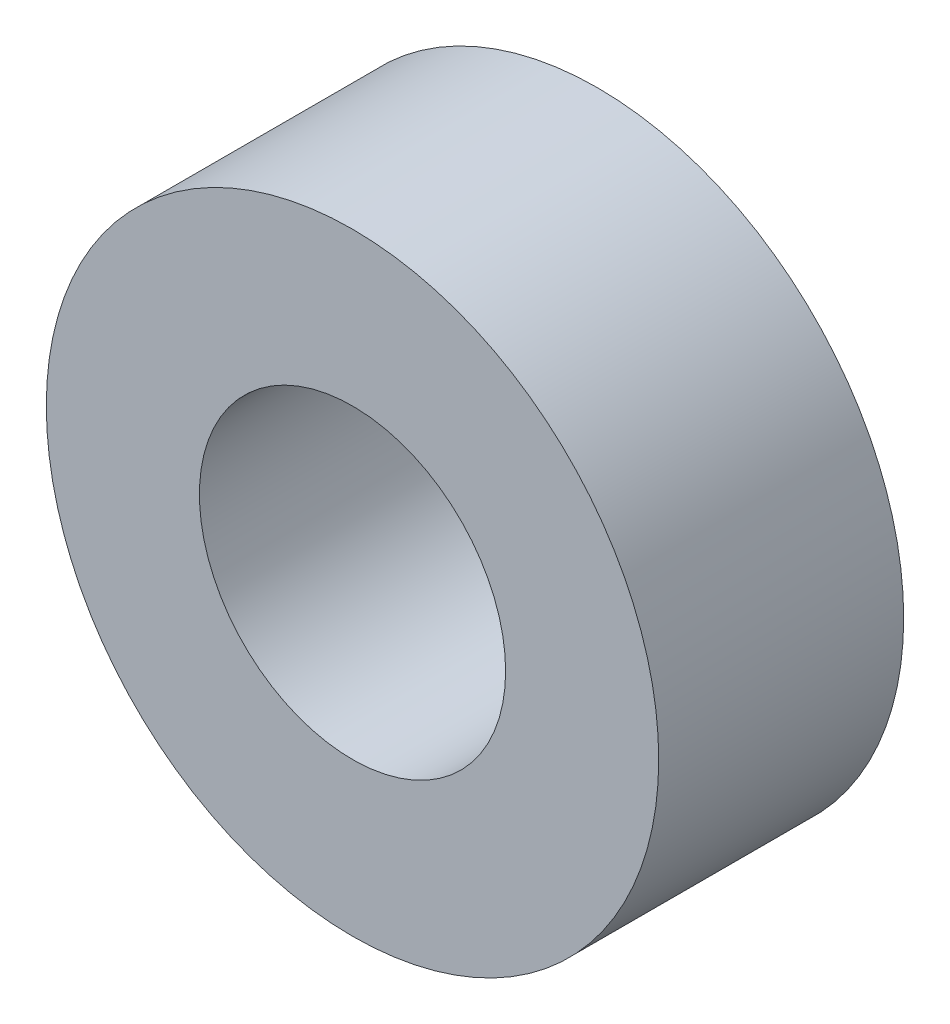
from build123d import *

# Parameters (mm, degrees)
SKETCH_1_R          = 6
EXTRUDE_1_DEPTH     = 1
SKETCH_2_R          = 5
EXTRUDE_2_DEPTH     = 3
SKETCH_3_R          = 2.5
CUT_EXTRUDE_1_DEPTH = 7
CUT_EXTRUDE_START   = -10
SKETCH_4_R          = 6
SKETCH_4_R_2        = 5
CUT_EXTRUDE_2_DEPTH = 10


with BuildPart() as part:
    # 草图1 → 凸台-拉伸1 (new body)
    with BuildSketch(Plane.XY):
        Circle(SKETCH_1_R)
    extrude(amount=EXTRUDE_1_DEPTH)

    # 草图2 → 凸台-拉伸2 (add)
    with BuildSketch(Plane.XY.offset(1)):
        Circle(SKETCH_2_R)
    extrude(amount=EXTRUDE_2_DEPTH)

    # 草图3 → 切除-拉伸1 (cut)
    with BuildSketch(Plane.XY.offset(4)):
        Circle(SKETCH_3_R)
    extrude(amount=-CUT_EXTRUDE_1_DEPTH, mode=Mode.SUBTRACT)

    # 草图4 → 切除-拉伸2 (cut)
    with BuildSketch(Plane.XY.offset(1).offset(CUT_EXTRUDE_START)):
        Circle(SKETCH_4_R)
        Circle(SKETCH_4_R_2, mode=Mode.SUBTRACT)
    extrude(amount=CUT_EXTRUDE_2_DEPTH, mode=Mode.SUBTRACT)


solid = part.part
